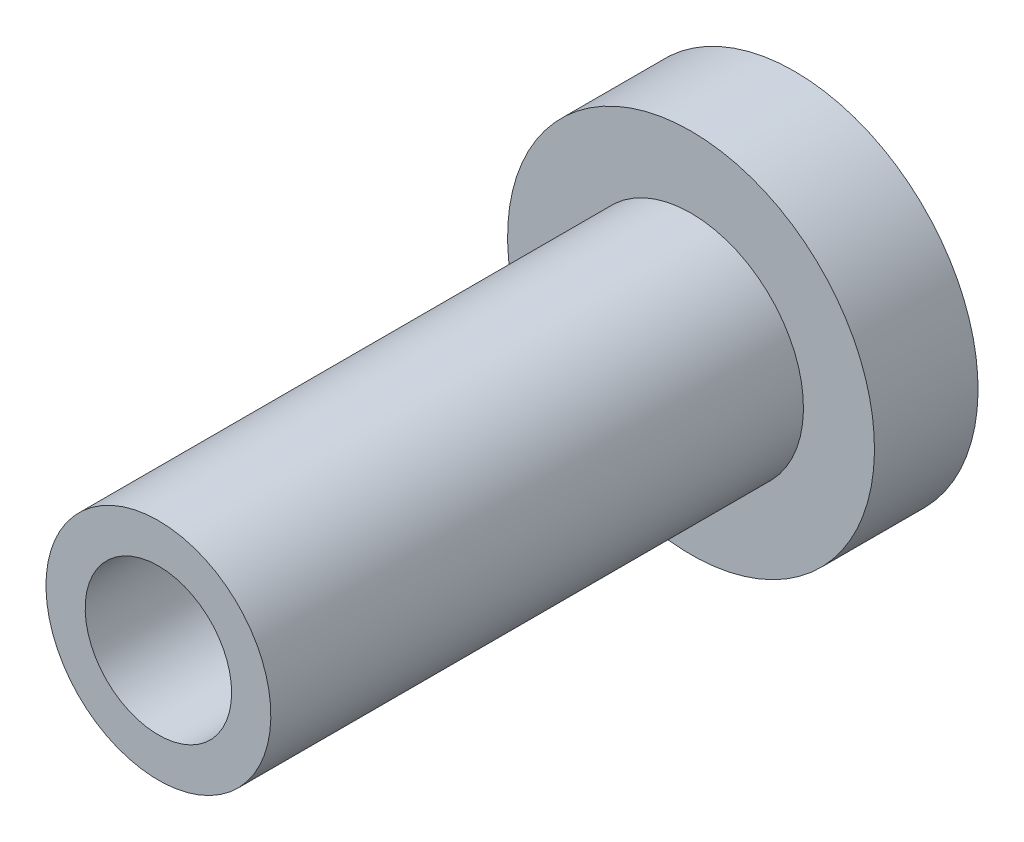
from build123d import *

# Parameters (mm, degrees)
CUT_EXTRUDE1_DEPTH      = 24.219173112
CUT_EXTRUDE1_DEPTH_BACK = 24.219173112
SKETCH3_R               = 2.475


with BuildPart() as part:
    # Sketch1 → Revolve1 (revolve)
    with BuildSketch(Plane(origin=(0, 0, 0), x_dir=(0, 0, -1), z_dir=(1, 0, 0)), mode=Mode.PRIVATE) as revolve1_sk:
        Polygon((0, 0), (-21.5, 0), (-21.5, -3.8), (-3.5, -3.8), (-3.5, -6.2), (0, -6.2), align=None)
    revolve(revolve1_sk.sketch.rotate(Axis((0, 0, 0), (0, 0, 1)), 180), axis=Axis((0, 0, 0), (0, 0, 1)))

    # Sketch3 → Cut-Extrude1 (cut, two sides: drawn at the far end of the back side and taken through both)
    with BuildSketch(Plane.XY.offset(21.5).offset(-CUT_EXTRUDE1_DEPTH_BACK)):
        Circle(SKETCH3_R)
    extrude(amount=CUT_EXTRUDE1_DEPTH + CUT_EXTRUDE1_DEPTH_BACK, mode=Mode.SUBTRACT)


solid = part.part
